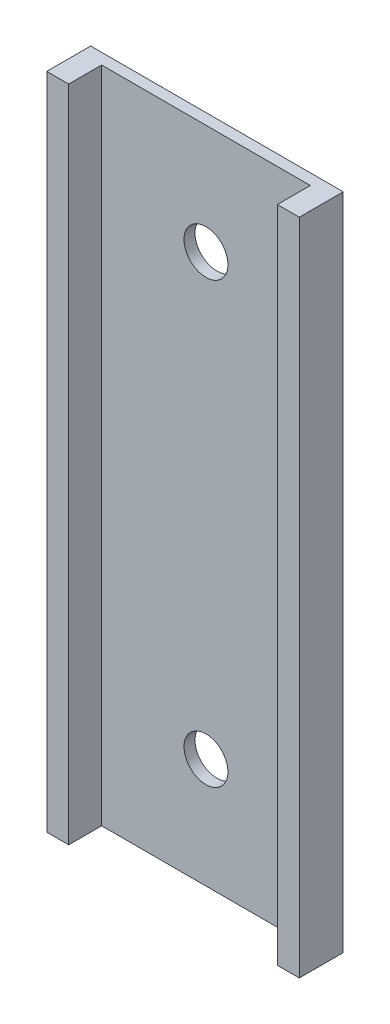
from build123d import *

# Parameters (mm, degrees)
SKETCH1_W           = 23
SKETCH1_H           = 60
BOSS_EXTRUDE1_DEPTH = 4
SKETCH2_W           = 19
SKETCH2_H           = 3.65261657
CUT_EXTRUDE1_DEPTH  = 65.399961729
SKETCH4_R           = 2
CUT_EXTRUDE2_DEPTH  = 103.729507508


with BuildPart() as part:
    # Sketch1 → Boss-Extrude1 (new body)
    with BuildSketch(Plane.XY):
        with Locations((11.551140333, -70.029978717)):
            Rectangle(SKETCH1_W, SKETCH1_H)
    extrude(amount=BOSS_EXTRUDE1_DEPTH)

    # Sketch2 → Cut-Extrude1 (cut, through all)
    with BuildSketch(Plane(origin=(0, -40.029978717, 0), x_dir=(1, 0, 0), z_dir=(0, 1, 0))):
        with Locations((11.551140333, -2.826308285)):
            Rectangle(SKETCH2_W, SKETCH2_H)
    extrude(amount=-CUT_EXTRUDE1_DEPTH, mode=Mode.SUBTRACT)

    # Sketch4 → Cut-Extrude2 (cut, through all)
    with BuildSketch(Plane(origin=(0, 0, 0), x_dir=(-1, 0, 0), z_dir=(0, 0, -1))):
        with Locations((-11.551140333, -50.029978717)):
            Circle(SKETCH4_R)
        with Locations((-11.551140333, -90.029978717)):
            Circle(SKETCH4_R)
    extrude(amount=-CUT_EXTRUDE2_DEPTH, mode=Mode.SUBTRACT)


solid = part.part
